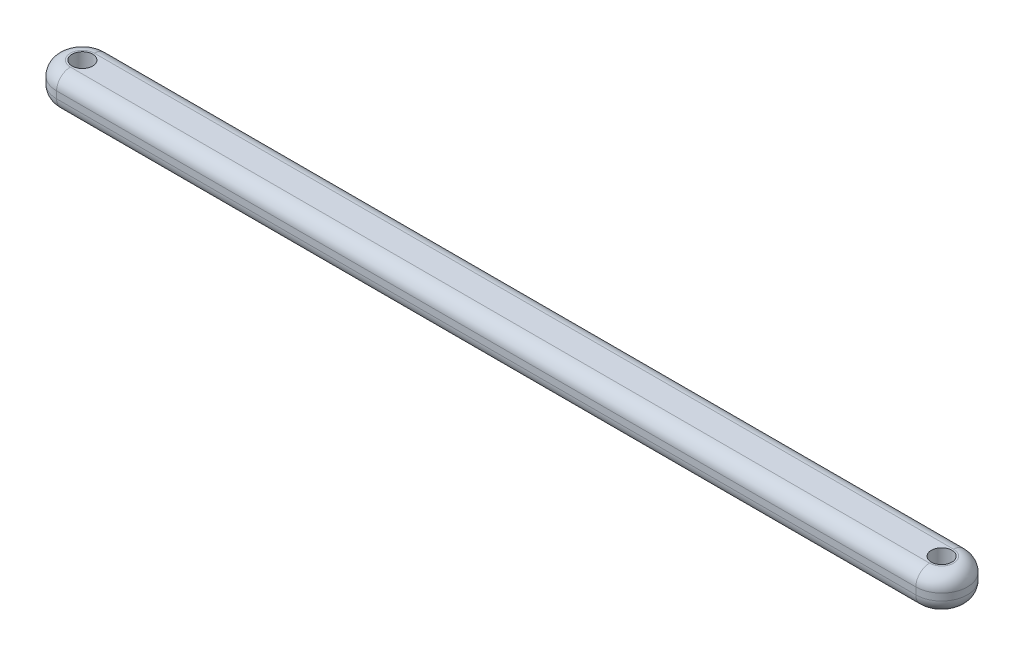
from build123d import *

# Parameters (mm, degrees)
CROQUIS1_R              = 3
SALIENTE_EXTRUIR1_DEPTH = 5
REDONDEO3_R             = 4


with BuildPart() as part:
    # Croquis1 → Saliente-Extruir1 (new, symmetric)
    with BuildSketch(Plane(origin=(0, 0, 0), x_dir=(-1, 0, 0), z_dir=(0, 1, 0))):
        with BuildLine():
            Line((0, -7.5), (250, -7.5))
            ThreePointArc((250, -7.5), (257.5, 0), (250, 7.5))
            Line((250, 7.5), (0, 7.5))
            ThreePointArc((0, 7.5), (-7.5, 0), (0, -7.5))
        make_face()
        with Locations(Location((0, 0, 0), (0, 0, 90))):
            Circle(CROQUIS1_R, mode=Mode.SUBTRACT)
        with Locations(Location((250, 0, 0), (0, 0, 90))):
            Circle(CROQUIS1_R, mode=Mode.SUBTRACT)
    extrude(amount=SALIENTE_EXTRUIR1_DEPTH, both=True)

    # Redondeo3
    redondeo3_edges = [part.edges().sort_by_distance(p)[0] for p in [
        (7.5, 5, 0),
        (-125, 5, -7.5),
        (-257.5, 5, 0),
        (-125, -5, -7.5),
        (7.5, -5, 0),
        (-125, -5, 7.5),
        (-257.5, -5, 0),
        (-125, 5, 7.5),
    ]]
    fillet(redondeo3_edges, radius=REDONDEO3_R)


solid = part.part
